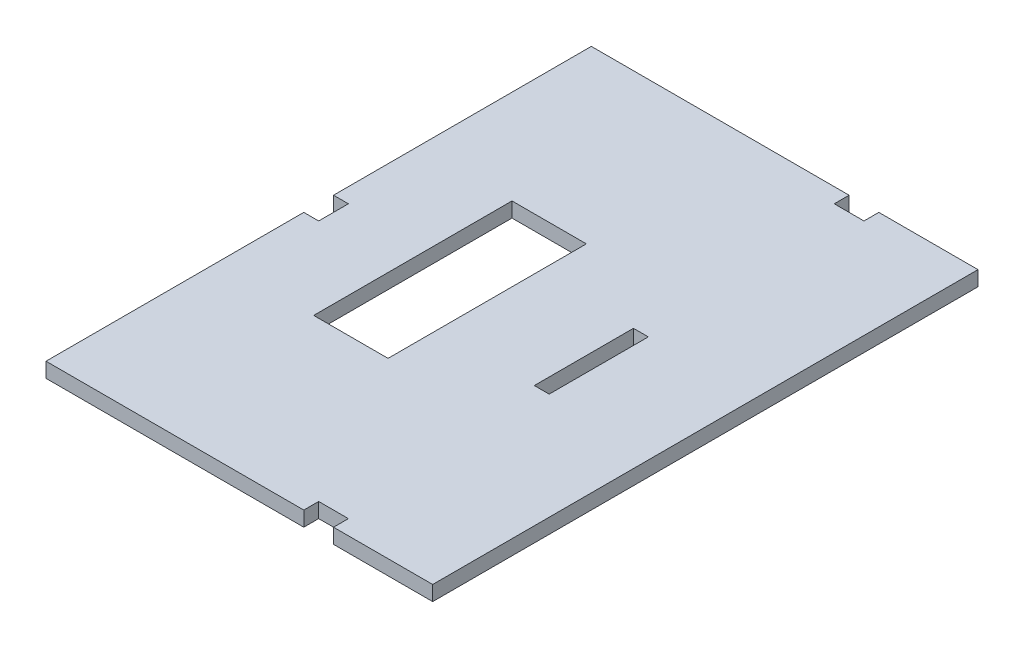
from build123d import *

# Parameters (mm, degrees)
EXTRUDE_3_DEPTH    = 3
SKETCH1_W          = 15
SKETCH1_H          = 40
SKETCH1_W_2        = 3
SKETCH1_H_2        = 20
CUT_EXTRUDE1_DEPTH = 10


with BuildPart() as part:
    # Эскиз4 → Бобышка-Вытянуть3 (new body)
    with BuildSketch(Plane(origin=(0, 0, 0), x_dir=(1, 0, 0), z_dir=(0, 1, 0))):
        Polygon((78, 0), (78, 110), (58, 110), (58, 107), (55, 107), (52, 107), (52, 110), (0, 110), (0, 58), (3, 58), (3, 55), (3, 52), (0, 52), (0, 0), (52, 0), (52, 3), (55, 3), (58, 3), (58, 0), align=None)
    extrude(amount=EXTRUDE_3_DEPTH)

    # Sketch1 → Cut-Extrude1 (cut)
    with BuildSketch(Plane(origin=(0, 3, 0), x_dir=(1, 0, 0), z_dir=(0, 1, 0))):
        with Locations((26.5, 55)):
            Rectangle(SKETCH1_W, SKETCH1_H)
        with Locations((55, 55)):
            Rectangle(SKETCH1_W_2, SKETCH1_H_2)
    extrude(amount=-CUT_EXTRUDE1_DEPTH, mode=Mode.SUBTRACT)


solid = part.part
